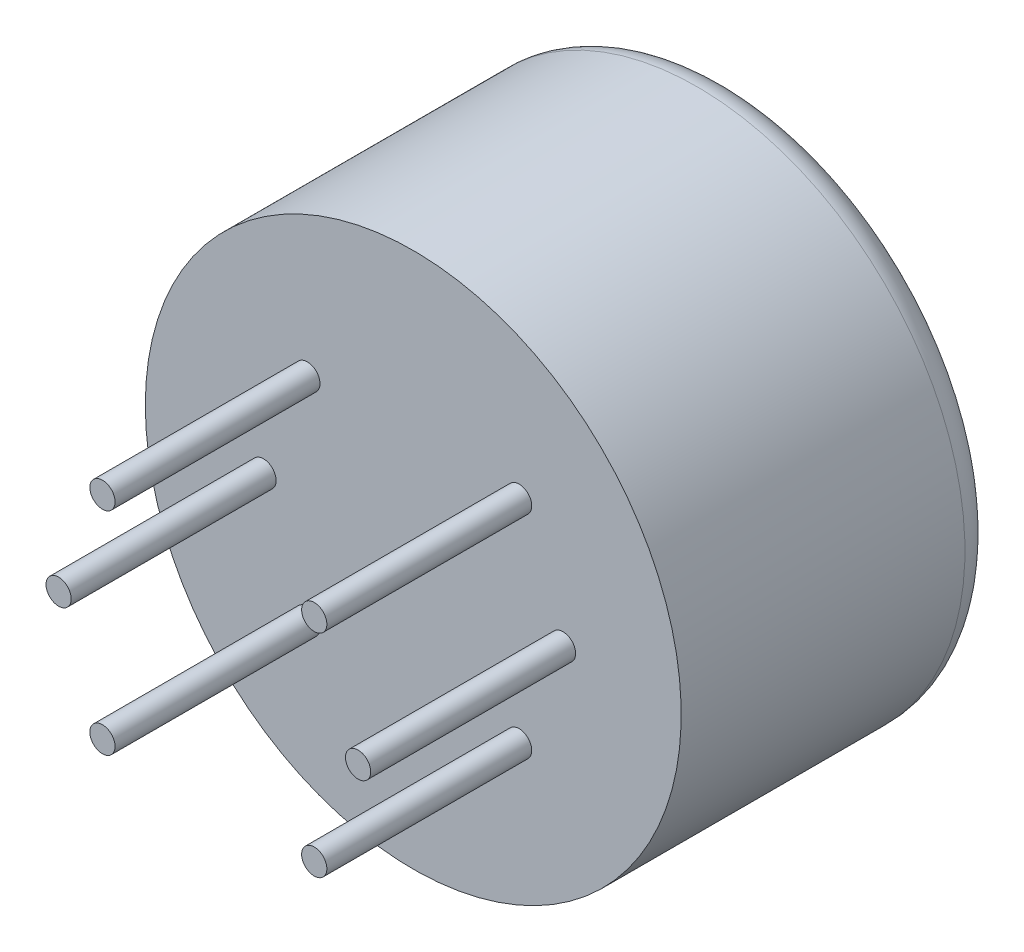
from build123d import *

# Parameters (mm, degrees)
SKETCH_2_R      = 0.4
EXTRUDE_1_DEPTH = 6.5


with BuildPart() as part:
    # 草图1 → 旋转1 (revolve)
    with BuildSketch(Plane(origin=(0, 0, 0), x_dir=(1, 0, 0), z_dir=(0, 1, 0)), mode=Mode.PRIVATE) as revolve_1_sk:
        with BuildLine():
            Line((0, 8), (0, 0))
            Line((0, 0), (8.5, 0))
            Line((8.5, 0), (8.5, 9))
            ThreePointArc((8.5, 9), (8.207106781, 9.707106781), (7.5, 10))
            Line((7.5, 10), (4.55, 10))
            ThreePointArc((4.55, 10), (4.337867966, 9.912132034), (4.25, 9.7))
            Line((4.25, 9.7), (4.25, 8.3))
            ThreePointArc((4.25, 8.3), (4.162132034, 8.087867966), (3.95, 8))
            Line((3.95, 8), (0, 8))
        make_face()
    revolve(revolve_1_sk.sketch.rotate(Axis((0, 0, -9.831715268), (0, 0, 1)), 180), axis=Axis((0, 0, -9.831715268), (0, 0, 1)))

    # 草图2 → 凸台-拉伸1 (add)
    with BuildSketch(Plane.XY):
        with Locations(Location((-4.75, 0, 0), (0, 0, 180))):
            Circle(SKETCH_2_R)
        with Locations(Location((-3.358757211, 3.358757211, 0), (0, 0, 180))):
            Circle(SKETCH_2_R)
        with Locations(Location((3.358757211, 3.358757211, 0), (0, 0, 180))):
            Circle(SKETCH_2_R)
        with Locations(Location((4.75, 0, 0), (0, 0, 180))):
            Circle(SKETCH_2_R)
        with Locations(Location((3.358757211, -3.358757211, 0), (0, 0, 180))):
            Circle(SKETCH_2_R)
        with Locations(Location((-3.358757211, -3.358757211, 0), (0, 0, 180))):
            Circle(SKETCH_2_R)
    extrude(amount=EXTRUDE_1_DEPTH)


solid = part.part
